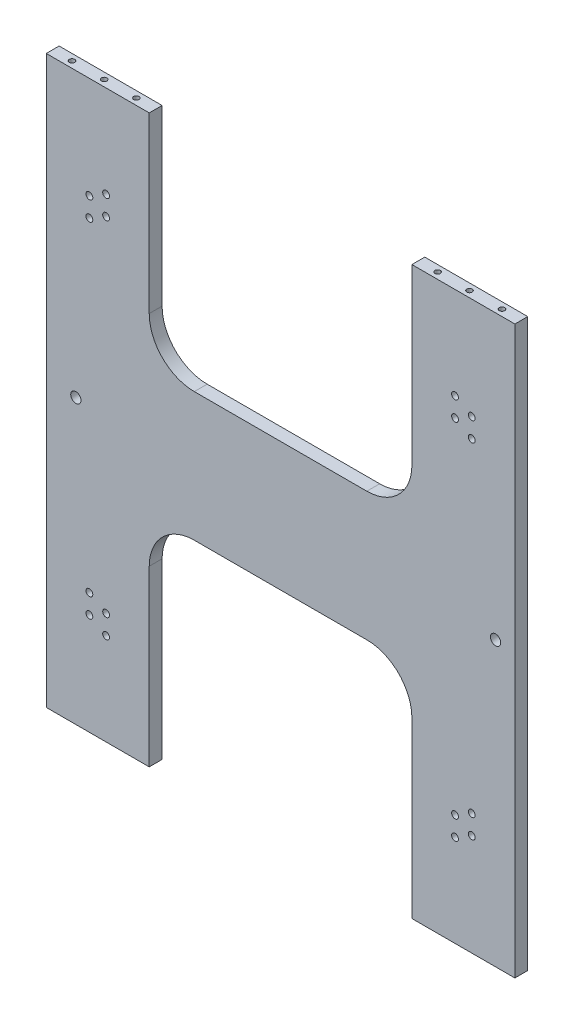
from build123d import *

# Parameters (mm, degrees)
SALIENTE_EXTRUIR1_DEPTH                              = 10
PERFORADOR_PARA_ROSCAR_PARA_MACHO_DE_2_COUNT         = 2
PERFORADOR_PARA_ROSCAR_PARA_MACHO_DE_2_PITCH         = 50
PERFORADOR_PARA_ROSCAR_PARA_MACHO_DE_3_COUNT         = 2
PERFORADOR_PARA_ROSCAR_PARA_MACHO_DE_3_PITCH         = 114.274917137
PERFORADOR_PARA_ROSCAR_PARA_MACHO_DE_4_COUNT         = 2
PERFORADOR_PARA_ROSCAR_PARA_MACHO_DE_4_PITCH         = 25
PERFORADOR_PARA_ROSCAR_PARA_MACHO_DE_5_A_COUNT       = 2
PERFORADOR_PARA_ROSCAR_PARA_MACHO_DE_5_A_PITCH       = 50
PERFORADOR_PARA_ROSCAR_PARA_MACHO_DE_6_COUNT         = 2
PERFORADOR_PARA_ROSCAR_PARA_MACHO_DE_6_PITCH         = 24.875395913
REFRENTADO_PARA_TORNILLO_TAP_N_CON_CABEZ_D           = 5.3
REFRENTADO_PARA_TORNILLO_TAP_N_CON_CABEZ_CSINK_D     = 11.2
REFRENTADO_PARA_TORNILLO_TAP_N_CON_CABEZ_CSINK_ANGLE = 90
SIMETR_A3_COPY_1_D                                   = 5.3
SIMETR_A3_COPY_1_CSINK_D                             = 11.2
SIMETR_A3_COPY_1_CSINK_ANGLE                         = 90
CORTAR_EXTRUIR1_DEPTH                                = 286.71506895
CORTAR_EXTRUIR1_DEPTH_BACK                           = 286.71506895
CROQUIS8_R                                           = 4


with BuildPart() as part:
    # Croquis1 → Saliente-Extruir1 (new body)
    with BuildSketch(Plane.XY):
        with BuildLine():
            Line((-67.025, 50), (67.025, 50))
            ThreePointArc((67.025, 50), (91.773737342, 60.251262658), (102.025, 85))
            Line((102.025, 85), (102.025, 220))
            Line((102.025, 220), (182.025, 220))
            Line((182.025, 220), (182.025, 60))
            Line((182.025, 60), (182.025, -60))
            Line((182.025, -60), (182.025, -220))
            Line((182.025, -220), (102.025, -220))
            Line((102.025, -220), (102.025, -85))
            ThreePointArc((102.025, -85), (91.773737342, -60.251262658), (67.025, -50))
            Line((67.025, -50), (-67.025, -50))
            ThreePointArc((-67.025, -50), (-91.773737342, -60.251262658), (-102.025, -85))
            Line((-102.025, -85), (-102.025, -220))
            Line((-102.025, -220), (-182.025, -220))
            Line((-182.025, -220), (-182.025, -60))
            Line((-182.025, -60), (-182.025, 60))
            Line((-182.025, 60), (-182.025, 220))
            Line((-182.025, 220), (-102.025, 220))
            Line((-102.025, 220), (-102.025, 85))
            ThreePointArc((-102.025, 85), (-91.773737342, 60.251262658), (-67.025, 50))
        make_face()
    extrude(amount=SALIENTE_EXTRUIR1_DEPTH)

    # Croquis3 → Perforador para roscar para macho de ros (revolve, cut)
    with BuildSketch(Plane(origin=(-167.025, 220, 5), x_dir=(0, 0, 1), z_dir=(1, 0, 0))):
        Polygon((0, 0), (0, 76.2618073), (2.1, 75), (2.1, 0), align=None)
    perforador_para_roscar_para_macho_de_ros = revolve(axis=Axis((-167.025, 226.35, 5), (0, -1, 0)), mode=Mode.SUBTRACT)

    # Perforador para roscar para macho de 2: Perforador para roscar para macho de ros ×2
    with Locations(*[(i * PERFORADOR_PARA_ROSCAR_PARA_MACHO_DE_2_PITCH, 0, 0) for i in range(1, PERFORADOR_PARA_ROSCAR_PARA_MACHO_DE_2_COUNT)]):
        add(perforador_para_roscar_para_macho_de_ros, mode=Mode.SUBTRACT)

    # Perforador para roscar para macho de 3: Perforador para roscar para macho de ros ×2
    with Locations(*[Vector(-0.9105437359751597, 0, -0.4134127536450694) * (i * PERFORADOR_PARA_ROSCAR_PARA_MACHO_DE_3_PITCH) for i in range(1, PERFORADOR_PARA_ROSCAR_PARA_MACHO_DE_3_COUNT)]):
        add(perforador_para_roscar_para_macho_de_ros, mode=Mode.SUBTRACT)

    # Perforador para roscar para macho de 4: Perforador para roscar para macho de ros ×2
    with Locations(*[(i * PERFORADOR_PARA_ROSCAR_PARA_MACHO_DE_4_PITCH, 0, 0) for i in range(1, PERFORADOR_PARA_ROSCAR_PARA_MACHO_DE_4_COUNT)]):
        add(perforador_para_roscar_para_macho_de_ros, mode=Mode.SUBTRACT)

    # Croquis5 → Perforador para roscar para macho de 5 (revolve, cut)
    with BuildSketch(Plane(origin=(117.025, 220, 5), x_dir=(0, 0, 1), z_dir=(1, 0, 0))):
        Polygon((0, 0), (0, 76.2618073), (2.1, 75), (2.1, 0), align=None)
    perforador_para_roscar_para_macho_de_5 = revolve(axis=Axis((117.025, 226.35, 5), (0, -1, 0)), mode=Mode.SUBTRACT)

    # Perforador para roscar para macho de 5 a: Perforador para roscar para macho de 5 ×2
    with Locations(*[(i * PERFORADOR_PARA_ROSCAR_PARA_MACHO_DE_5_A_PITCH, 0, 0) for i in range(1, PERFORADOR_PARA_ROSCAR_PARA_MACHO_DE_5_A_COUNT)]):
        add(perforador_para_roscar_para_macho_de_5, mode=Mode.SUBTRACT)

    # Perforador para roscar para macho de 6: Perforador para roscar para macho de 5 ×2
    with Locations(*[Vector(0.9999846303252095, 0, 0.005544286550521713) * (i * PERFORADOR_PARA_ROSCAR_PARA_MACHO_DE_6_PITCH) for i in range(1, PERFORADOR_PARA_ROSCAR_PARA_MACHO_DE_6_COUNT)]):
        add(perforador_para_roscar_para_macho_de_5, mode=Mode.SUBTRACT)

    # Simetría1: Perforador para roscar para macho de ros, Perforador para roscar para macho de 5 across plane
    add(perforador_para_roscar_para_macho_de_ros.mirror(Plane.ZX), mode=Mode.SUBTRACT)
    add(perforador_para_roscar_para_macho_de_5.mirror(Plane.ZX), mode=Mode.SUBTRACT)

    # Simetría1 copy 1 sketch → Simetría1 copy 1 (revolve, cut)
    with BuildSketch(Plane(origin=(-117.025, -220, 5), x_dir=(0, 0, 1), z_dir=(1, 0, 0))):
        Polygon((0, 0), (0, -76.2618073), (2.1, -75), (2.1, 0), align=None)
    revolve(axis=Axis((-117.025, -226.35, 5), (0, -1, 0)), mode=Mode.SUBTRACT)

    # Simetría1 copy 2 sketch → Simetría1 copy 2 (revolve, cut)
    with BuildSketch(Plane(origin=(-271.077309978, -220, -42.242708166), x_dir=(0, 0, 1), z_dir=(1, 0, 0))):
        Polygon((0, 0), (0, -76.2618073), (2.1, -75), (2.1, 0), align=None)
    revolve(axis=Axis((-271.077309978, -226.35, -42.242708166), (0, -1, 0)), mode=Mode.SUBTRACT)

    # Simetría1 copy 3 sketch → Simetría1 copy 3 (revolve, cut)
    with BuildSketch(Plane(origin=(-142.025, -220, 5), x_dir=(0, 0, 1), z_dir=(1, 0, 0))):
        Polygon((0, 0), (0, -76.2618073), (2.1, -75), (2.1, 0), align=None)
    revolve(axis=Axis((-142.025, -226.35, 5), (0, -1, 0)), mode=Mode.SUBTRACT)

    # Simetría1 copy 4 sketch → Simetría1 copy 4 (revolve, cut)
    with BuildSketch(Plane(origin=(167.025, -220, 5), x_dir=(0, 0, 1), z_dir=(1, 0, 0))):
        Polygon((0, 0), (0, -76.2618073), (2.1, -75), (2.1, 0), align=None)
    revolve(axis=Axis((167.025, -226.35, 5), (0, -1, 0)), mode=Mode.SUBTRACT)

    # Simetría1 copy 5 sketch → Simetría1 copy 5 (revolve, cut)
    with BuildSketch(Plane(origin=(141.900013587, -220, 5.137916323), x_dir=(0, 0, 1), z_dir=(1, 0, 0))):
        Polygon((0, 0), (0, -76.2618073), (2.1, -75), (2.1, 0), align=None)
    revolve(axis=Axis((141.900013587, -226.35, 5.137916323), (0, -1, 0)), mode=Mode.SUBTRACT)

    # Refrentado para tornillo tapón con cabeza plana de clavija de M51 (through all)
    with Locations(Plane(origin=(148.520190528, -141, 0), x_dir=(-1, 0, 0), z_dir=(0, 0, -1))):
        with Locations((0, 0), (12.990381056, 7.5), (12.990381056, -7.5), (0, 15)):
            refrentado_para_tornillo_tap_n_con_cabez = CounterSinkHole(REFRENTADO_PARA_TORNILLO_TAP_N_CON_CABEZ_D / 2, REFRENTADO_PARA_TORNILLO_TAP_N_CON_CABEZ_CSINK_D / 2, counter_sink_angle=REFRENTADO_PARA_TORNILLO_TAP_N_CON_CABEZ_CSINK_ANGLE)

    # Simetría2: Refrentado para tornillo tapón con cabeza plana de clavija de M51 across plane
    add(refrentado_para_tornillo_tap_n_con_cabez.mirror(Plane.ZX), mode=Mode.SUBTRACT)

    # Simetría3: Refrentado para tornillo tapón con cabeza plana de clavija de M51 across plane
    add(refrentado_para_tornillo_tap_n_con_cabez.mirror(Plane(origin=(0, 0, 0), x_dir=(0, 0, 1), z_dir=(1, 0, 0))), mode=Mode.SUBTRACT)

    # Simetría3 copy 1 (through all)
    with Locations(Plane(origin=(-148.520190528, 141, 0), x_dir=(1, 0, 0), z_dir=(0, 0, -1))):
        with Locations((0, 0), (12.990381056, 7.5), (12.990381056, -7.5), (0, 15)):
            CounterSinkHole(SIMETR_A3_COPY_1_D / 2, SIMETR_A3_COPY_1_CSINK_D / 2, counter_sink_angle=SIMETR_A3_COPY_1_CSINK_ANGLE)

    # Croquis8 → Cortar-Extruir1 (cut, two sides: drawn at the far end of the back side and taken through both)
    with BuildSketch(Plane.XY.offset(10).offset(-CORTAR_EXTRUIR1_DEPTH_BACK)):
        with Locations((167.025, 0)):
            Circle(CROQUIS8_R)
        with Locations((-159.025, 0)):
            Circle(CROQUIS8_R)
    extrude(amount=CORTAR_EXTRUIR1_DEPTH + CORTAR_EXTRUIR1_DEPTH_BACK, mode=Mode.SUBTRACT)


solid = part.part
